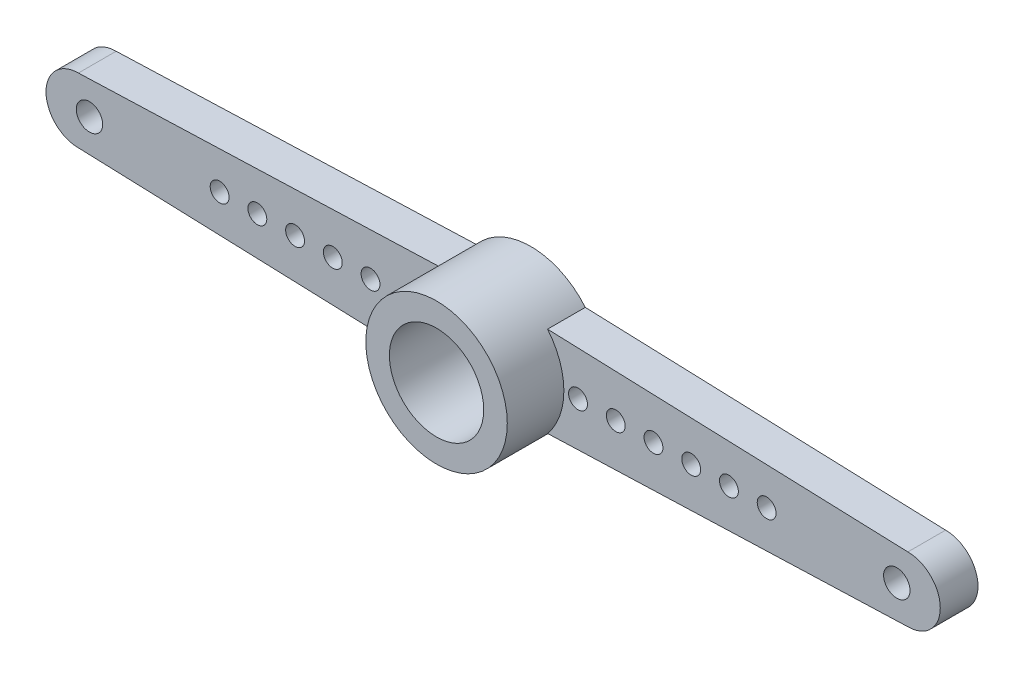
from build123d import *

# Parameters (mm, degrees)
EXTRUDE_3_DEPTH     = 2
EXTRUDE_3_2_DEPTH   = 2
SKETCH_2_R          = 3.75
SKETCH_2_R_2        = 2.5
EXTRUDE_5_DEPTH     = 3
EXTRUDE_START       = 2
SKETCH_3_R          = 3.75
SKETCH_3_R_2        = 2.5
EXTRUDE_6_DEPTH     = 2
SKETCH_4_R          = 0.5
CUT_EXTRUDE_1_DEPTH = 2
SKETCH_5_R          = 2.5
EXTRUDE_7_DEPTH     = 1
SKETCH_6_R          = 2.5
CUT_EXTRUDE_2_DEPTH = 0.5
SKETCH_7_R          = 1.25
CUT_EXTRUDE_3_DEPTH = 5
SKETCH4_R           = 0.7
CUT_EXTRUDE3_DEPTH  = 2
SKETCH5_R           = 0.7
CUT_EXTRUDE4_DEPTH  = 2


with BuildPart() as part:
    # Эскиз1 → Бобышка-Вытянуть3 (new body)
    with BuildSketch(Plane.XY):
        with BuildLine():
            ThreePointArc((-2.88547071, -2.395111434), (-3.527252129, -1.273182005), (-3.75, 0))
            ThreePointArc((-3.75, 0), (-3.527252129, 1.273182005), (-2.88547071, 2.395111434))
            Line((-2.88547071, 2.395111434), (-21.986200069, 1.718255157))
            ThreePointArc((-21.986200069, 1.718255157), (-23.704455226, 0), (-21.986200069, -1.718255157))
            Line((-21.986200069, -1.718255157), (-2.88547071, -2.395111434))
        make_face()
    extrude(amount=EXTRUDE_3_DEPTH)



with BuildPart() as body_2:
    # Эскиз1 → Extrude 3 2 (new body)
    with BuildSketch(Plane.XY):
        with BuildLine():
            Line((21.986200069, 1.718255157), (2.88547071, 2.395111434))
            ThreePointArc((2.88547071, 2.395111434), (3.75, 0), (2.88547071, -2.395111434))
            Line((2.88547071, -2.395111434), (21.986200069, -1.718255157))
            ThreePointArc((21.986200069, -1.718255157), (23.704455226, 0), (21.986200069, 1.718255157))
        make_face()
    extrude(amount=EXTRUDE_3_2_DEPTH)


with BuildPart() as body_3:
    # Эскиз2 → Бобышка-Вытянуть5 (new body)
    with BuildSketch(Plane.XY.offset(2)):
        Circle(SKETCH_2_R)
        Circle(SKETCH_2_R_2, mode=Mode.SUBTRACT)
    extrude(amount=EXTRUDE_5_DEPTH)


with BuildPart() as part_1:
    add(part.part)

    add(body_2.part)  # Бобышка-Вытянуть6 merges body 2

    add(body_3.part)  # Бобышка-Вытянуть6 merges body 3
    # Эскиз3 → Бобышка-Вытянуть6 (add)
    with BuildSketch(Plane(origin=(0, 0, 2), x_dir=(-1, 0, 0), z_dir=(0, 0, -1)).offset(EXTRUDE_START)):
        with Locations(Location((0, 0, 0), (0, 0, 180))):
            Circle(SKETCH_3_R)
        with Locations(Location((0, 0, 0), (0, 0, 180))):
            Circle(SKETCH_3_R_2, mode=Mode.SUBTRACT)
    extrude(amount=-EXTRUDE_6_DEPTH)

    # Эскиз4 → Вырез-Вытянуть1 (cut)
    with BuildSketch(Plane(origin=(0, 0, 0), x_dir=(-1, 0, 0), z_dir=(0, 0, -1))):
        with Locations((-14.5, 0)):
            Circle(SKETCH_4_R)
        with Locations((-4.5, 0)):
            Circle(SKETCH_4_R)
        with Locations((-6.5, 0)):
            Circle(SKETCH_4_R)
        with Locations((-8.5, 0)):
            Circle(SKETCH_4_R)
        with Locations((-10.5, 0)):
            Circle(SKETCH_4_R)
        with Locations((-12.5, 0)):
            Circle(SKETCH_4_R)
        with Locations((4.5, 0)):
            Circle(SKETCH_4_R)
        with Locations((6.5, 0)):
            Circle(SKETCH_4_R)
        with Locations((8.5, 0)):
            Circle(SKETCH_4_R)
        with Locations((10.5, 0)):
            Circle(SKETCH_4_R)
        with Locations((12.5, 0)):
            Circle(SKETCH_4_R)
        with Locations((14.5, 0)):
            Circle(SKETCH_4_R)
    extrude(amount=-CUT_EXTRUDE_1_DEPTH, mode=Mode.SUBTRACT)

    # Эскиз5 → Бобышка-Вытянуть7 (add)
    with BuildSketch(Plane(origin=(0, 0, 0), x_dir=(-1, 0, 0), z_dir=(0, 0, -1))):
        with Locations(Location((0, 0, 0), (0, 0, 180))):
            Circle(SKETCH_5_R)
    extrude(amount=-EXTRUDE_7_DEPTH)

    # Эскиз6 → Вырез-Вытянуть2 (cut)
    with BuildSketch(Plane(origin=(0, 0, 0), x_dir=(-1, 0, 0), z_dir=(0, 0, -1))):
        with Locations(Location((0, 0, 0), (0, 0, 180))):
            Circle(SKETCH_6_R)
    extrude(amount=-CUT_EXTRUDE_2_DEPTH, mode=Mode.SUBTRACT)

    # Эскиз7 → Вырез-Вытянуть3 (cut)
    with BuildSketch(Plane(origin=(0, 0, 0.5), x_dir=(-1, 0, 0), z_dir=(0, 0, -1))):
        Circle(SKETCH_7_R)
    extrude(amount=-CUT_EXTRUDE_3_DEPTH, mode=Mode.SUBTRACT)

    # Sketch4 → Cut-Extrude3 (cut)
    with BuildSketch(Plane(origin=(0, 0, 0), x_dir=(-1, 0, 0), z_dir=(0, 0, -1))):
        with Locations((21.4, 0)):
            Circle(SKETCH4_R)
    extrude(amount=-CUT_EXTRUDE3_DEPTH, mode=Mode.SUBTRACT)

    # Sketch5 → Cut-Extrude4 (cut)
    with BuildSketch(Plane(origin=(0, 0, 0), x_dir=(-1, 0, 0), z_dir=(0, 0, -1))):
        with Locations((-21.4, 0)):
            Circle(SKETCH5_R)
    extrude(amount=-CUT_EXTRUDE4_DEPTH, mode=Mode.SUBTRACT)


solid = part_1.part
